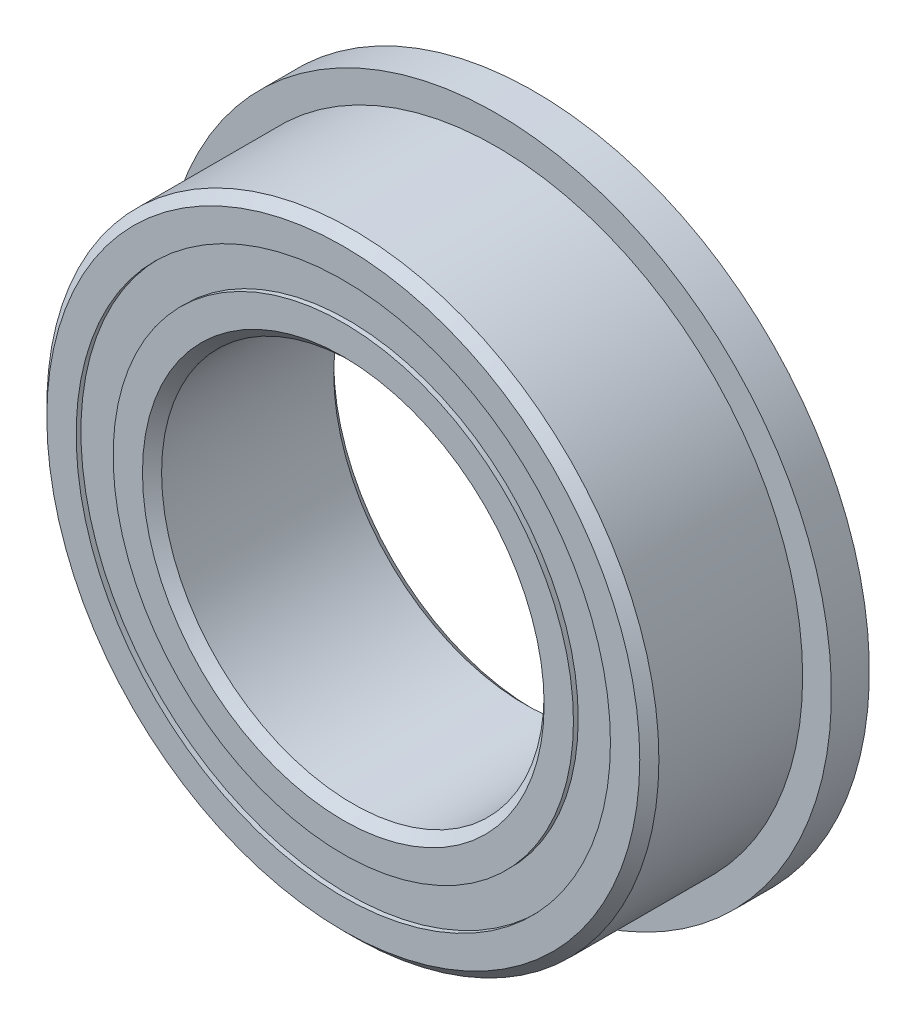
from build123d import *

# Parameters (mm, degrees)
CIRPATTERN1_COUNT = 12
SKETCH5_W         = 0.923323783
SKETCH5_H         = 0.767582418
SKETCH6_W         = 0.7874
SKETCH6_H         = 1.403733791


with BuildPart() as part:
    # Sketch1 → Revolve1 (revolve)
    with BuildSketch(Plane(origin=(0, 0, 0), x_dir=(0, 0, -1), z_dir=(1, 0, 0))):
        with BuildLine():
            Line((1.7859375, 6.35), (-1.7859375, 6.35))
            Line((-1.7859375, 6.35), (-1.984375, 6.1515625))
            Line((-1.984375, 6.1515625), (-1.984375, 5.543166209))
            Line((-1.984375, 5.543166209), (-0.881944444, 5.543166209))
            ThreePointArc((-0.881944444, 5.543166209), (0, 6.121207467), (0.881944444, 5.543166209))
            Line((0.881944444, 5.543166209), (1.984375, 5.543166209))
            Line((1.984375, 5.543166209), (1.984375, 6.1515625))
            Line((1.984375, 6.1515625), (1.7859375, 6.35))
        make_face()
    revolve(axis=Axis((0, 0, 1.984375), (0, 0, -1)))

    # Sketch6 → Revolve6 (revolve)
    with BuildSketch(Plane(origin=(0, 0, 0), x_dir=(0, 0, -1), z_dir=(1, 0, 0))):
        with Locations((1.590675, 6.245033105)):
            Rectangle(SKETCH6_W, SKETCH6_H)
    revolve(axis=Axis((0, 0, -1.984375), (0, 0, 1)))


with BuildPart() as body_2:
    # Sketch3 → Revolve3 (revolve)
    with BuildSketch(Plane(origin=(0, 0, 0), x_dir=(0, 0, -1), z_dir=(1, 0, 0))):
        with BuildLine():
            Line((-1.984375, 4.775583791), (-0.881944444, 4.775583791))
            ThreePointArc((-0.881944444, 4.775583791), (0, 4.197542533), (0.881944444, 4.775583791))
            Line((0.881944444, 4.775583791), (1.984375, 4.775583791))
            Line((1.984375, 4.775583791), (1.984375, 4.1671875))
            Line((1.984375, 4.1671875), (1.7859375, 3.96875))
            Line((1.7859375, 3.96875), (-1.7859375, 3.96875))
            Line((-1.7859375, 3.96875), (-1.984375, 4.1671875))
            Line((-1.984375, 4.1671875), (-1.984375, 4.775583791))
        make_face()
    revolve(axis=Axis((0, 0, 1.984375), (0, 0, -1)))


with BuildPart() as body_3:
    # Sketch4 → Revolve4 (revolve)
    with BuildSketch(Plane(origin=(0, 0, 0), x_dir=(0, 0, -1), z_dir=(1, 0, 0))):
        with BuildLine():
            Line((-0.961832467, 5.159375), (0.961832467, 5.159375))
            ThreePointArc((0.961832467, 5.159375), (0, 6.121207467), (-0.961832467, 5.159375))
        make_face()
    revolve(axis=Axis((0, 5.159375, 0.961832467), (0, 0, -1)))


with BuildPart() as cirpattern1_1:
    # CirPattern1: pattern copy
    add(body_3.part.rotate(Axis((0, 0, -1.984375), (0, 0, 1)), 1 * 360 / CIRPATTERN1_COUNT))


with BuildPart() as cirpattern1_2:
    # CirPattern1: pattern copy
    add(body_3.part.rotate(Axis((0, 0, -1.984375), (0, 0, 1)), 2 * 360 / CIRPATTERN1_COUNT))


with BuildPart() as cirpattern1_3:
    # CirPattern1: pattern copy
    add(body_3.part.rotate(Axis((0, 0, -1.984375), (0, 0, 1)), 3 * 360 / CIRPATTERN1_COUNT))


with BuildPart() as cirpattern1_4:
    # CirPattern1: pattern copy
    add(body_3.part.rotate(Axis((0, 0, -1.984375), (0, 0, 1)), 4 * 360 / CIRPATTERN1_COUNT))


with BuildPart() as cirpattern1_5:
    # CirPattern1: pattern copy
    add(body_3.part.rotate(Axis((0, 0, -1.984375), (0, 0, 1)), 5 * 360 / CIRPATTERN1_COUNT))


with BuildPart() as cirpattern1_6:
    # CirPattern1: pattern copy
    add(body_3.part.rotate(Axis((0, 0, -1.984375), (0, 0, 1)), 6 * 360 / CIRPATTERN1_COUNT))


with BuildPart() as cirpattern1_7:
    # CirPattern1: pattern copy
    add(body_3.part.rotate(Axis((0, 0, -1.984375), (0, 0, 1)), 7 * 360 / CIRPATTERN1_COUNT))


with BuildPart() as cirpattern1_8:
    # CirPattern1: pattern copy
    add(body_3.part.rotate(Axis((0, 0, -1.984375), (0, 0, 1)), 8 * 360 / CIRPATTERN1_COUNT))


with BuildPart() as cirpattern1_9:
    # CirPattern1: pattern copy
    add(body_3.part.rotate(Axis((0, 0, -1.984375), (0, 0, 1)), 9 * 360 / CIRPATTERN1_COUNT))


with BuildPart() as cirpattern1_10:
    # CirPattern1: pattern copy
    add(body_3.part.rotate(Axis((0, 0, -1.984375), (0, 0, 1)), 10 * 360 / CIRPATTERN1_COUNT))


with BuildPart() as cirpattern1_11:
    # CirPattern1: pattern copy
    add(body_3.part.rotate(Axis((0, 0, -1.984375), (0, 0, 1)), 11 * 360 / CIRPATTERN1_COUNT))


with BuildPart() as body_15:
    # Sketch5 → Revolve5 (revolve)
    with BuildSketch(Plane(origin=(0, 0, 0), x_dir=(0, 0, -1), z_dir=(1, 0, 0))):
        with Locations((-1.423494359, 5.159375)):
            Rectangle(SKETCH5_W, SKETCH5_H)
        with Locations((1.423494359, 5.159375)):
            Rectangle(SKETCH5_W, SKETCH5_H)
    revolve(axis=Axis((0, 0, 1.984375), (0, 0, -1)))


solid = Compound([part.part, body_2.part, body_3.part, cirpattern1_1.part, cirpattern1_2.part, cirpattern1_3.part, cirpattern1_4.part, cirpattern1_5.part, cirpattern1_6.part, cirpattern1_7.part, cirpattern1_8.part, cirpattern1_9.part, cirpattern1_10.part, cirpattern1_11.part, body_15.part])
